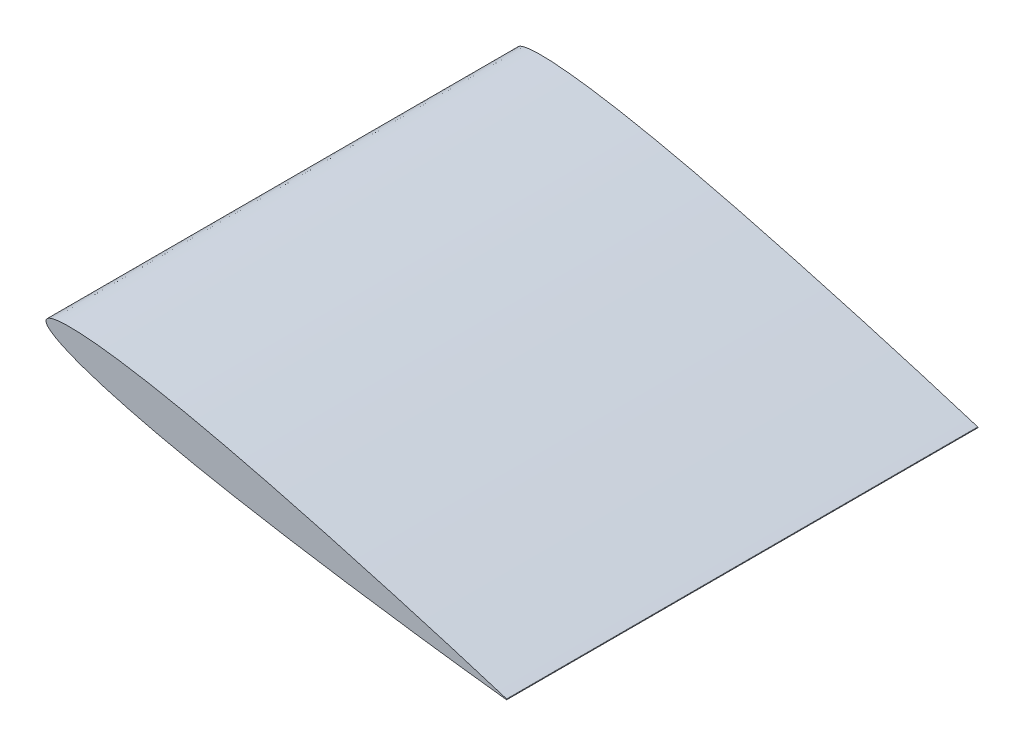
from build123d import *

# Parameters (mm, degrees)
BOSS_EXTRUDE1_DEPTH = 190.5


with BuildPart() as part:
    # Sketch1 → Boss-Extrude1 (new body)
    with BuildSketch(Plane.XY):
        with BuildLine():
            ThreePointArc((139.643654691, -29.51862919), (139.752838455, -29.705382826), (139.577010513, -29.831408812))
            add(Edge.make_bspline(
                [(139.643654691, -29.51862919), (139.403803472, -29.443706884), (139.02939808, -29.326547562), (138.490706232, -29.158272353), (137.997990221, -29.004678474), (137.416863032, -28.823648734), (136.747744913, -28.615553309), (135.991464547, -28.38035859), (135.148443982, -28.11910725), (134.21969818, -27.831786664), (133.206250512, -27.518371247), (132.108753533, -27.180447391), (130.928495403, -26.817365825), (129.666481777, -26.430212139), (128.323946272, -26.019389675), (126.902154756, -25.585806821), (125.402601831, -25.129423879), (123.826553929, -24.651382307), (122.175592431, -24.152445141), (120.451457585, -23.632627506), (118.655648827, -23.093179081), (116.78976052, -22.534820999), (114.855909374, -21.957644513), (112.855756373, -21.363249717), (110.791340118, -20.751991062), (108.664684923, -20.124469204), (106.477703956, -19.481887725), (104.232663615, -18.824716461), (101.931713668, -18.153818232), (99.576879378, -17.470471725), (97.170777948, -16.774840576), (94.715565178, -16.068206246), (92.21362778, -15.351530087), (89.667516354, -14.625211259), (87.079456012, -13.890990973), (84.452179333, -13.14907654), (81.788216268, -12.400379498), (79.089947736, -11.646585709), (76.360322522, -10.88783581), (73.601729014, -10.125539206), (70.816996868, -9.360508834), (67.06004734, -8.335197909), (63.276547931, -7.312283399), (59.469596361, -6.294819427), (56.594568696, -5.531604117), (53.709576083, -4.772396375), (50.817670808, -4.017654426), (47.921638226, -3.268322845), (45.024083832, -2.526052443), (42.127894206, -1.791406141), (39.235866866, -1.065276552), (36.350718604, -0.349412673), (33.475324791, 0.355853611), (30.612366014, 1.048896178), (27.764728323, 1.729452044), (24.934945273, 2.395530325), (22.126053783, 3.047253716), (19.340362932, 3.682483054), (16.580992257, 4.301744972), (13.850123995, 4.902586674), (10.275896077, 5.674199932), (6.747095037, 6.412326564), (3.266942401, 7.113955858), (0.718952259, 7.614642103), (-1.784949454, 8.092968906), (-4.242219209, 8.548767057), (-6.650669539, 8.980595646), (-9.007631025, 9.389001706), (-11.311050567, 9.772441751), (-13.558538257, 10.131357676), (-15.747904953, 10.464953476), (-17.876978602, 10.773167852), (-20.587777225, 11.14328253), (-23.212843453, 11.46874269), (-25.749485671, 11.745542876), (-27.546815233, 11.92240224), (-29.272089334, 12.073516595), (-30.923736324, 12.197484889), (-32.49993688, 12.295371502), (-33.999163099, 12.366677733), (-35.419975131, 12.411630295), (-36.760881025, 12.430383549), (-38.020559825, 12.42278413), (-39.19769601, 12.38944718), (-40.291287736, 12.33054876), (-41.300192406, 12.245560695), (-42.223498403, 12.135371511), (-43.060366271, 12.000288646), (-43.810001458, 11.839567647), (-44.47210769, 11.654479809), (-45.046195367, 11.444165567), (-45.532258628, 11.20897922), (-45.930549147, 10.948218628), (-46.240168449, 10.659854569), (-46.459666916, 10.342513593), (-46.583899002, 9.997519511), (-46.611088824, 9.631848564), (-46.540014259, 9.252594984), (-46.374834304, 8.863065107), (-46.117432537, 8.462595689), (-45.76945658, 8.049700007), (-45.330962831, 7.623634315), (-44.801812221, 7.184724526), (-44.182802213, 6.732385314), (-43.473685125, 6.267898325), (-42.67548996, 5.790907653), (-41.788857944, 5.302036227), (-40.81425932, 4.802467005), (-39.752952745, 4.292183451), (-38.605781282, 3.771754719), (-37.373695437, 3.242278777), (-36.057963953, 2.704154048), (-34.659886272, 2.158129659), (-33.180684772, 1.604999564), (-31.621957936, 1.044931204), (-29.984933191, 0.479638131), (-28.2716168, -0.091518357), (-25.842461446, -0.872784222), (-23.312726644, -1.645661216), (-20.686502993, -2.412709703), (-18.616711265, -2.999150585), (-16.481516889, -3.586992115), (-14.282928252, -4.175404864), (-12.023268836, -4.764223326), (-9.704540844, -5.352069778), (-7.32924823, -5.93951673), (-4.899605572, -6.524976512), (-2.418197709, -7.108873197), (0.112583771, -7.690324466), (3.576476116, -8.468267818), (7.0996691, -9.232714612), (10.677993732, -9.985100857), (13.416596318, -10.549643233), (16.188734462, -11.108983868), (18.991415624, -11.664472964), (21.822005887, -12.214357996), (24.677524728, -12.759651068), (27.555249015, -13.299002186), (30.452053693, -13.83319655), (33.365196177, -14.361297849), (36.291565839, -14.883698262), (39.228401758, -15.399528751), (42.172510161, -15.909278939), (45.120972645, -16.412623548), (48.070923879, -16.908899932), (51.01931174, -17.398553432), (53.963207754, -17.881311172), (56.899637952, -18.356347359), (60.790690388, -18.979102622), (64.662549436, -19.587320832), (68.511141458, -20.182528101), (71.365858648, -20.619099245), (74.195593093, -21.047511688), (76.997429529, -21.467354291), (79.768612485, -21.878940455), (82.506391966, -22.281196572), (85.207906632, -22.674691534), (87.870474695, -23.059226409), (90.491516408, -23.433876608), (93.068290142, -23.799325074), (95.59830412, -24.154896583), (98.078987045, -24.500496082), (100.507847991, -24.836414952), (102.882430369, -25.161735749), (105.200363582, -25.476800535), (107.459332867, -25.781520866), (109.657077149, -26.075401907), (111.79135881, -26.35876283), (113.860084507, -26.631326937), (115.861248215, -26.892586889), (117.792680962, -27.143326728), (119.652412687, -27.382766936), (121.438693544, -27.610916094), (123.14964492, -27.828304116), (124.783671551, -28.034235427), (126.339018365, -28.228762164), (127.814063629, -28.412410401), (129.207458737, -28.584534636), (130.517677477, -28.745448346), (131.743428961, -28.895016975), (132.883352357, -29.033821883), (133.936536054, -29.160745093), (134.901737504, -29.276969207), (135.778032651, -29.3820537), (136.564499835, -29.475573308), (137.260328633, -29.558308102), (137.864776039, -29.629889592), (138.564386007, -29.712602181), (139.124913198, -29.778289147), (139.514542111, -29.824060369), (139.577010513, -29.831408812)],
                knots=[0, 0, 0, 0, 0.001960488, 0.003060783, 0.004403151, 0.0059871, 0.007809627, 0.009870238, 0.012166335, 0.014695452, 0.017455125, 0.020442713, 0.023654809, 0.027089354, 0.030741825, 0.034608687, 0.038686488, 0.042971159, 0.047458181, 0.052142622, 0.057020911, 0.062087544, 0.067338084, 0.072766456, 0.078367198, 0.084135835, 0.090065843, 0.096151268, 0.102386612, 0.108765354, 0.11528158, 0.121927783, 0.128698472, 0.135586708, 0.14258496, 0.14968731, 0.156886298, 0.164174398, 0.171545202, 0.178990235, 0.186503524, 0.1940766, 0.209373857, 0.217082105, 0.224820878, 0.232581679, 0.240357098, 0.248139213, 0.255920557, 0.263693736, 0.271450842, 0.279184434, 0.286886143, 0.294549552, 0.302166305, 0.309729004, 0.317230803, 0.324663343, 0.332020788, 0.339294805, 0.34647908, 0.360549207, 0.367421989, 0.374177392, 0.38080867, 0.387310567, 0.393675894, 0.399898905, 0.405973449, 0.411894305, 0.417655823, 0.423251855, 0.428678294, 0.439001415, 0.443888497, 0.448586274, 0.453091622, 0.457400294, 0.461508301, 0.46541243, 0.469110006, 0.472598492, 0.475874567, 0.478937452, 0.481785324, 0.484418023, 0.486835408, 0.489038388, 0.491029428, 0.49281391, 0.494397941, 0.495793426, 0.497018052, 0.498098706, 0.499074548, 0.5, 0.500925452, 0.501901294, 0.502981948, 0.504206574, 0.505602059, 0.50718609, 0.508970572, 0.510961612, 0.513164592, 0.515581977, 0.518214676, 0.521062548, 0.524125433, 0.527401508, 0.530889994, 0.53458757, 0.538491699, 0.542599706, 0.546908378, 0.551413726, 0.556111503, 0.560998585, 0.571321706, 0.576748145, 0.582344177, 0.588105695, 0.594026551, 0.600101095, 0.606324106, 0.612689433, 0.61919133, 0.625822608, 0.632578011, 0.639450793, 0.65352092, 0.660705195, 0.667979212, 0.675336657, 0.682769197, 0.690270996, 0.697833695, 0.705450448, 0.713113857, 0.720815566, 0.728549158, 0.736306264, 0.744079443, 0.751860787, 0.759642902, 0.767418321, 0.775179122, 0.782917895, 0.790626143, 0.8059234, 0.813496476, 0.821009765, 0.828454798, 0.835825602, 0.843113702, 0.85031269, 0.85741504, 0.864413292, 0.871301528, 0.878072217, 0.88471842, 0.891234646, 0.897613388, 0.903848732, 0.909934157, 0.915864165, 0.921632802, 0.927233544, 0.932661916, 0.937912456, 0.942979089, 0.947857378, 0.952541819, 0.957028841, 0.961313512, 0.965391313, 0.969258175, 0.972910646, 0.976345191, 0.979557287, 0.982544875, 0.985304548, 0.987833665, 0.990129762, 0.992190373, 0.9940129, 0.995596849, 0.996939217, 0.999509262, 1, 1, 1, 1], degree=3))
        make_face()
    extrude(amount=-BOSS_EXTRUDE1_DEPTH)


solid = part.part
